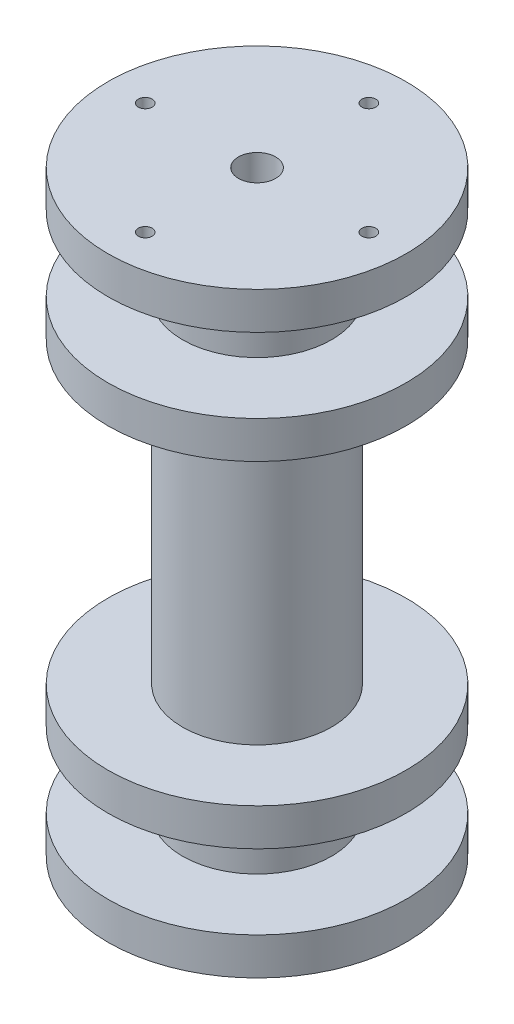
from build123d import *

# Parameters (mm, degrees)
SKETCH1_R           = 25.4
BOSS_EXTRUDE1_DEPTH = 101.6
SKETCH2_W           = 12.7
SKETCH2_H           = 12.7
SKETCH2_H_2         = 50.8
CUT_EXTRUDE1_REACH  = 109.763
SKETCH3_R           = 3.175
CUT_EXTRUDE2_REACH  = 109.763
SKETCH4_R           = 1.18745


with BuildPart() as part:
    # Sketch1 → Boss-Extrude1 (new body)
    with BuildSketch(Plane(origin=(0, 0, 0), x_dir=(1, 0, 0), z_dir=(0, 1, 0))):
        with Locations(Location((0, 0, 0), (0, 0, 270))):
            Circle(SKETCH1_R)
    extrude(amount=BOSS_EXTRUDE1_DEPTH)

    # Sketch2 → Cut-Revolve1 (revolve, cut)
    with BuildSketch(Plane(origin=(0, 0, 0), x_dir=(0, 0, -1), z_dir=(1, 0, 0)), mode=Mode.PRIVATE) as cut_revolve1_sk:
        with Locations((19.05, 88.9)):
            Rectangle(SKETCH2_W, SKETCH2_H)
        with Locations((19.05, 12.7)):
            Rectangle(SKETCH2_W, SKETCH2_H)
        with Locations((19.05, 50.8)):
            Rectangle(SKETCH2_W, SKETCH2_H_2)
    revolve(cut_revolve1_sk.sketch.rotate(Axis((0, 101.6, 0), (0, -1, 0)), 180), axis=Axis((0, 101.6, 0), (0, -1, 0)), mode=Mode.SUBTRACT)

    # Sketch3 → Cut-Extrude1 (cut, up to next)
    with BuildSketch(Plane(origin=(0, 101.6, 0), x_dir=(1, 0, 0), z_dir=(0, 1, 0)), mode=Mode.PRIVATE) as cut_extrude1_sk1:
        with Locations(Location((0, 0, 0), (0, 0, 270))):
            Circle(SKETCH3_R)
    cut_extrude1_tool1 = extrude(cut_extrude1_sk1.sketch, amount=-CUT_EXTRUDE1_REACH, mode=Mode.PRIVATE) & part.part
    add(cut_extrude1_tool1.solids().sort_by_distance((0, 101.6, 0))[0], mode=Mode.SUBTRACT)

    # Sketch4 → Cut-Extrude2 (cut, up to next)
    with BuildSketch(Plane(origin=(0, 101.6, 0), x_dir=(1, 0, 0), z_dir=(0, 1, 0)), mode=Mode.PRIVATE) as cut_extrude2_sk1:
        with Locations(Location((-19.05, 0, 0), (0, 0, 270))):
            Circle(SKETCH4_R)
    cut_extrude2_tool1 = extrude(cut_extrude2_sk1.sketch, amount=-CUT_EXTRUDE2_REACH, mode=Mode.PRIVATE) & part.part
    # Sketch4 → Cut-Extrude2 (cut, up to next)
    with BuildSketch(Plane(origin=(0, 101.6, 0), x_dir=(1, 0, 0), z_dir=(0, 1, 0)), mode=Mode.PRIVATE) as cut_extrude2_sk2:
        with Locations(Location((0, 19.05, 0), (0, 0, 270))):
            Circle(SKETCH4_R)
    cut_extrude2_tool2 = extrude(cut_extrude2_sk2.sketch, amount=-CUT_EXTRUDE2_REACH, mode=Mode.PRIVATE) & part.part
    # Sketch4 → Cut-Extrude2 (cut, up to next)
    with BuildSketch(Plane(origin=(0, 101.6, 0), x_dir=(1, 0, 0), z_dir=(0, 1, 0)), mode=Mode.PRIVATE) as cut_extrude2_sk3:
        with Locations(Location((19.05, 0, 0), (0, 0, 270))):
            Circle(SKETCH4_R)
    cut_extrude2_tool3 = extrude(cut_extrude2_sk3.sketch, amount=-CUT_EXTRUDE2_REACH, mode=Mode.PRIVATE) & part.part
    # Sketch4 → Cut-Extrude2 (cut, up to next)
    with BuildSketch(Plane(origin=(0, 101.6, 0), x_dir=(1, 0, 0), z_dir=(0, 1, 0)), mode=Mode.PRIVATE) as cut_extrude2_sk4:
        with Locations(Location((0, -19.05, 0), (0, 0, 270))):
            Circle(SKETCH4_R)
    cut_extrude2_tool4 = extrude(cut_extrude2_sk4.sketch, amount=-CUT_EXTRUDE2_REACH, mode=Mode.PRIVATE) & part.part
    add(cut_extrude2_tool1.solids().sort_by_distance((-19.05, 101.6, 0))[0], mode=Mode.SUBTRACT)
    add(cut_extrude2_tool2.solids().sort_by_distance((0, 101.6, -19.05))[0], mode=Mode.SUBTRACT)
    add(cut_extrude2_tool3.solids().sort_by_distance((19.05, 101.6, 0))[0], mode=Mode.SUBTRACT)
    add(cut_extrude2_tool4.solids().sort_by_distance((0, 101.6, 19.05))[0], mode=Mode.SUBTRACT)


solid = part.part
